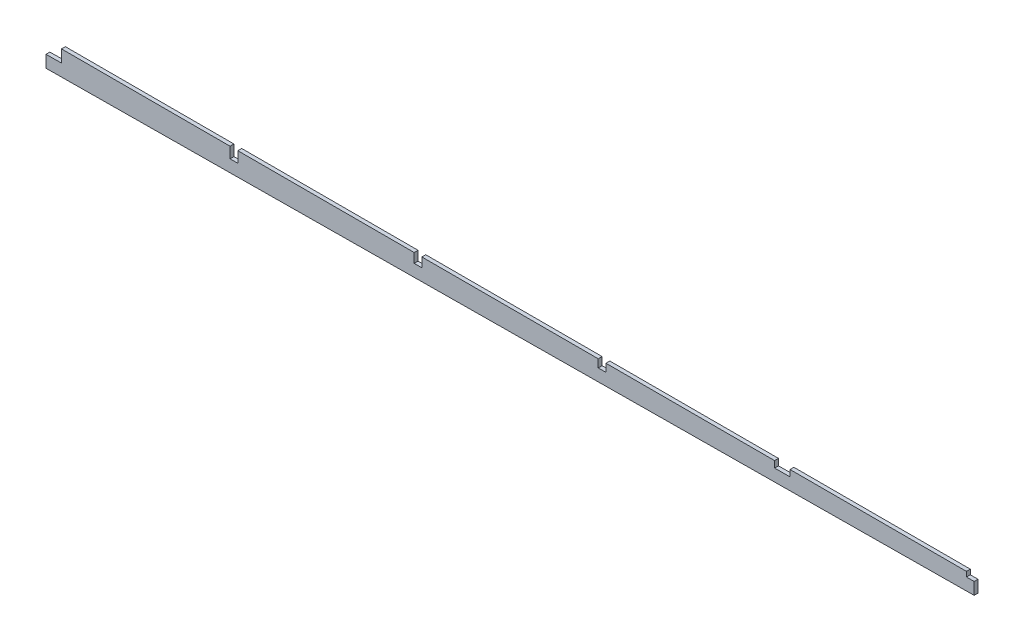
from build123d import *

# Parameters (mm, degrees)
BOSS_EXTRUDE1_DEPTH = 1.5875


with BuildPart() as part:
    # Sketch2 → Boss-Extrude1 (new body)
    with BuildSketch(Plane(origin=(0, 0, 1.5875), x_dir=(-1, 0, 0), z_dir=(0, 0, -1))):
        Polygon((88.325552841, -18.908548546), (88.325552841, -13.935751967), (81.975552841, -13.884120288), (81.975552841, -8.831667028), (12.760552841, -8.831667028), (12.760552841, -13.321334979), (9.585552841, -13.29551914), (9.585552841, -8.831667028), (-62.80444716, -8.831667028), (-62.80444716, -12.706917992), (-65.97944716, -12.681102152), (-65.97944716, -8.831667028), (-138.36944716, -8.831667028), (-138.36944716, -12.092501004), (-141.54444716, -12.066685164), (-141.54444716, -8.831667028), (-210.75944716, -8.831667028), (-210.75944716, -11.503899856), (-217.10944716, -11.452268176), (-217.10944716, -8.831667028), (-289.49944716, -8.831667028), (-289.49944716, -10.863667028), (-292.67444716, -10.837851188), (-292.67444716, -15.793203691), align=None)
    extrude(amount=BOSS_EXTRUDE1_DEPTH)


solid = part.part
